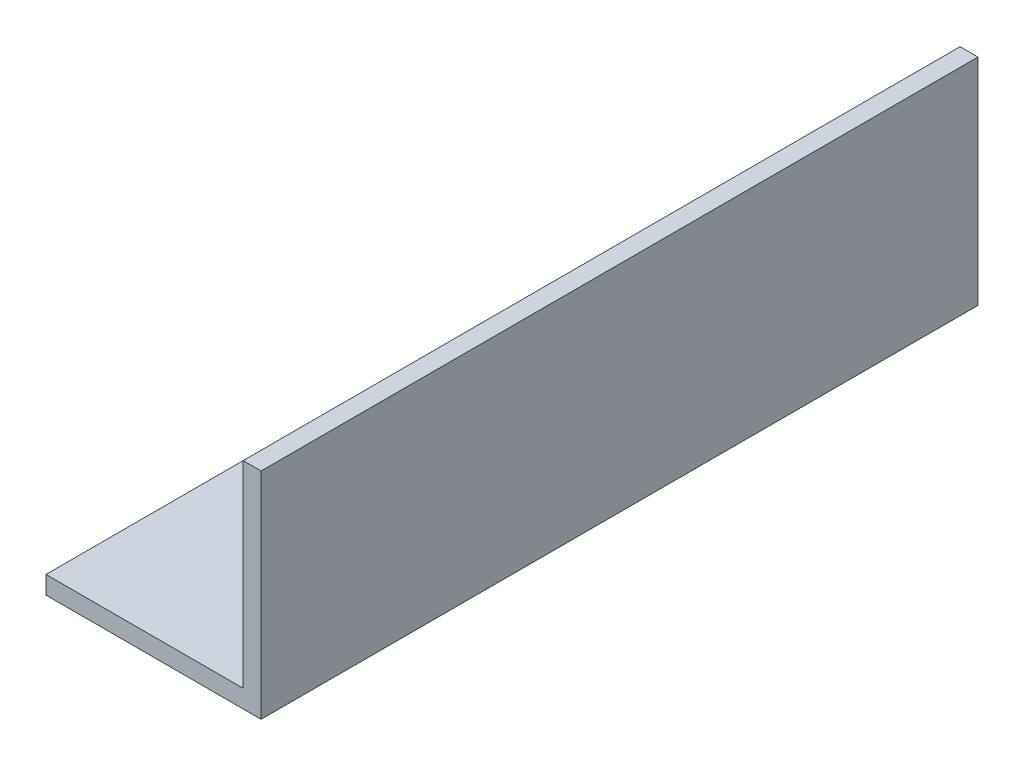
from build123d import *

# Parameters (mm, degrees)
SKETCH1_W           = 38.1
SKETCH1_H           = 38.1
BOSS_EXTRUDE1_DEPTH = 127
SKETCH3_W           = 34.925
SKETCH3_H           = 34.925
CUT_EXTRUDE1_DEPTH  = 127


with BuildPart() as part:
    # Sketch1 → Boss-Extrude1 (new body)
    with BuildSketch(Plane.XY):
        with Locations((19.05, 19.05)):
            Rectangle(SKETCH1_W, SKETCH1_H)
    extrude(amount=BOSS_EXTRUDE1_DEPTH)

    # Sketch3 → Cut-Extrude1 (cut)
    with BuildSketch(Plane.XY.offset(127)):
        with Locations((17.4625, 20.6375)):
            Rectangle(SKETCH3_W, SKETCH3_H)
    extrude(amount=-CUT_EXTRUDE1_DEPTH, mode=Mode.SUBTRACT)


solid = part.part
